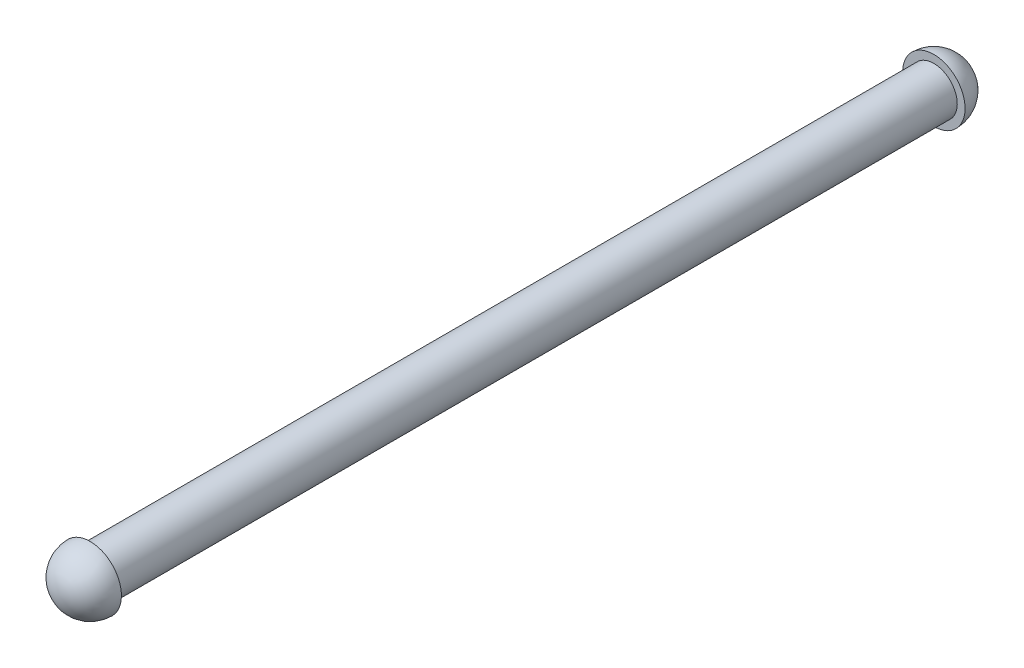
from build123d import *

# Parameters (mm, degrees)
REVOLVE_1_ANGLE = 180
SKETCH_2_R      = 0.375
EXTRUDE_1_DEPTH = 13.5
REVOLVE_2_ANGLE = 180


with BuildPart() as part:
    # 草图1 → 旋转1 (revolve)
    with BuildSketch(Plane.XY):
        with BuildLine():
            Line((-0.5, 0), (0.5, 0))
            ThreePointArc((0.5, 0), (0, -0.5), (-0.5, 0))
        make_face()
    revolve(axis=Axis((-0.5, 0, 0), (1, 0, 0)), revolution_arc=REVOLVE_1_ANGLE)

    # 草图2 → 凸台-拉伸1 (add)
    with BuildSketch(Plane.XY):
        with Locations(Location((0, 0, 0), (0, 0, 90))):
            Circle(SKETCH_2_R)
    extrude(amount=EXTRUDE_1_DEPTH)

    # 草图3 → 旋转2 (revolve)
    with BuildSketch(Plane.XY.offset(13.5)):
        with BuildLine():
            Line((0, 0.5), (0, -0.5))
            ThreePointArc((0, -0.5), (-0.5, 0), (0, 0.5))
        make_face()
    revolve(axis=Axis((0, 0.5, 13.5), (0, 1, 0)), revolution_arc=REVOLVE_2_ANGLE)


solid = part.part
